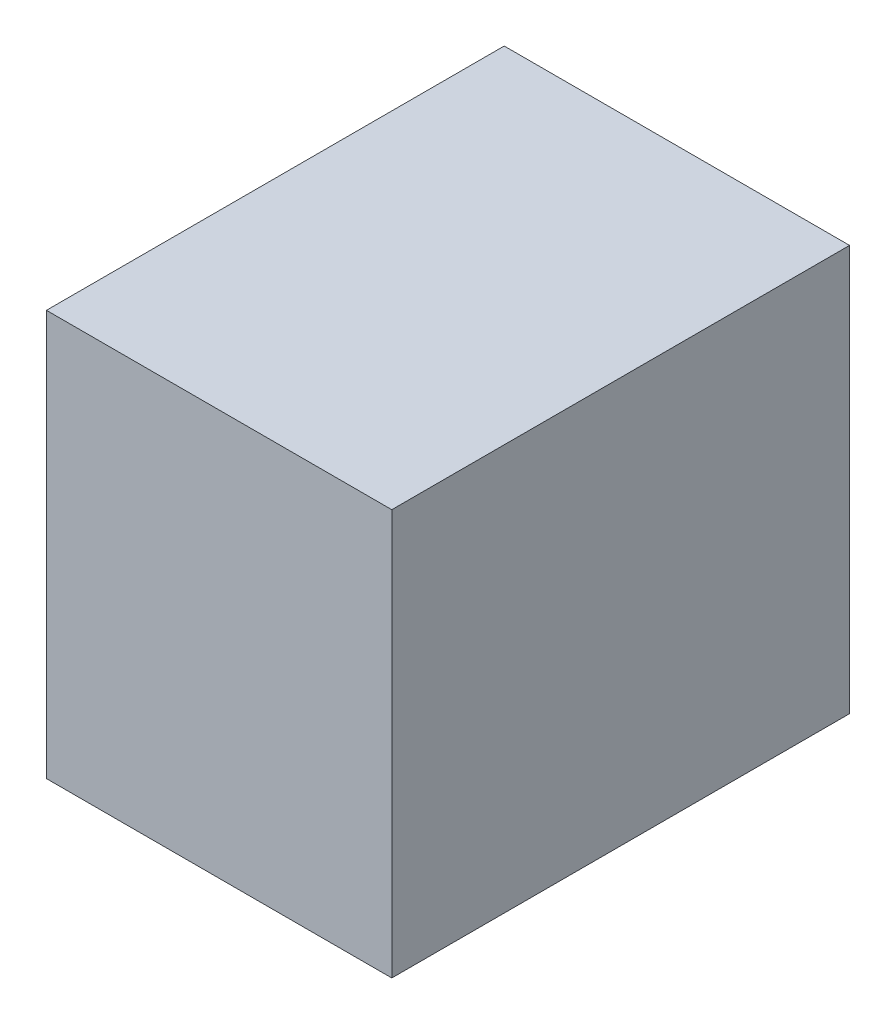
from build123d import *

# Parameters (mm, degrees)
BOSS_EXTRUDE1_DEPTH = 25.5
SKETCH2_W           = 21.5
SKETCH2_H           = 25.25
BOSS_EXTRUDE2_DEPTH = 3


with BuildPart() as part:
    # Sketch1 → Boss-Extrude1 (new body)
    with BuildSketch(Plane.XY):
        Polygon((-12.340425532, -6.996736248), (-12.340425532, 8.503263752), (-15.340425532, 8.503263752), (-15.340425532, -9.996736248), (6.159574468, -9.996736248), (6.159574468, 15.253263752), (-15.340425532, 15.253263752), (-15.340425532, 12.253263752), (3.159574468, 12.253263752), (3.159574468, -6.996736248), align=None)
    extrude(amount=BOSS_EXTRUDE1_DEPTH)

    # Sketch2 → Boss-Extrude2 (add)
    with BuildSketch(Plane.XY.offset(25.5)):
        with Locations((-4.590425532, 2.628263752)):
            Rectangle(SKETCH2_W, SKETCH2_H)
    extrude(amount=BOSS_EXTRUDE2_DEPTH)


solid = part.part
